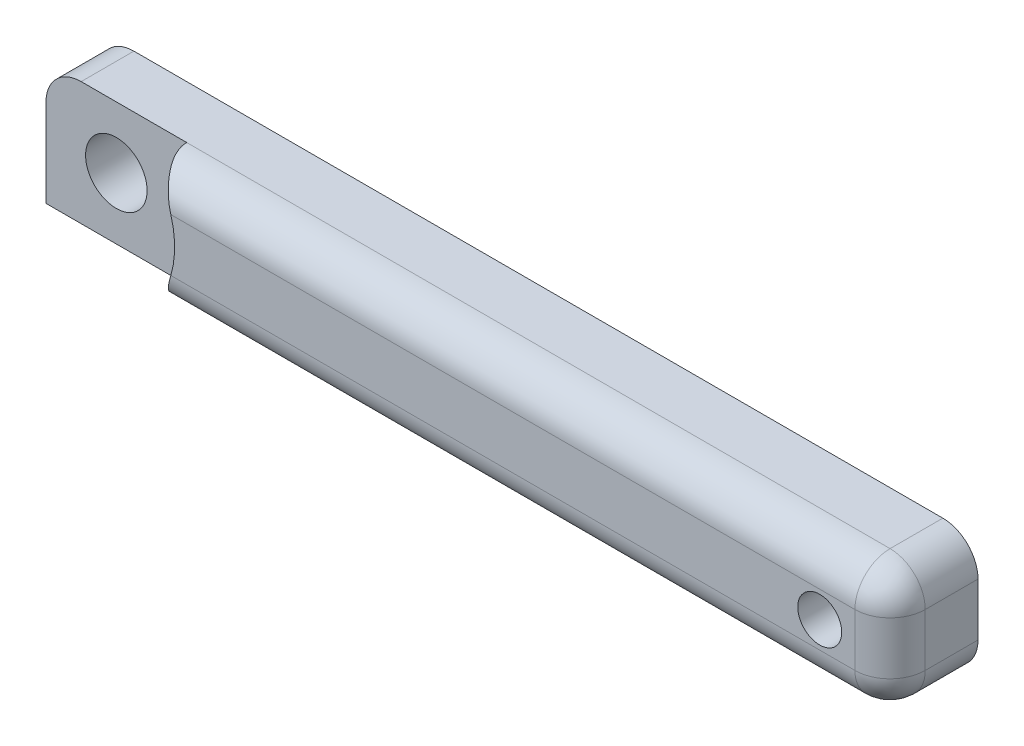
from build123d import *

# Parameters (mm, degrees)
BOSS_EXTRUDE1_DEPTH = 5
SKETCH2_R           = 2.4
CUT_EXTRUDE1_DEPTH  = 3
SKETCH3_R           = 1.25
CUT_EXTRUDE2_DEPTH  = 51.576674466
FILLET1_R           = 2
SKETCH4_R           = 1.75
CUT_EXTRUDE3_DEPTH  = 51.734603576
SKETCH5_R           = 5.315072906
CUT_EXTRUDE4_DEPTH  = 2


with BuildPart() as part:
    # Sketch1 → Boss-Extrude1 (new body)
    with BuildSketch(Plane.XY):
        with BuildLine():
            Line((0, 0), (48, 0))
            ThreePointArc((48, 0), (49.414213562, 0.585786438), (50, 2))
            Line((50, 2), (50, 5))
            ThreePointArc((50, 5), (49.414213562, 6.414213562), (48, 7))
            Line((48, 7), (2, 7))
            ThreePointArc((2, 7), (0.585786438, 6.414213562), (0, 5))
            Line((0, 5), (0, 0))
        make_face()
    extrude(amount=BOSS_EXTRUDE1_DEPTH)

    # Sketch2 → Cut-Extrude1 (cut)
    with BuildSketch(Plane(origin=(0, 0, 0), x_dir=(-1, 0, 0), z_dir=(0, 0, -1))):
        with Locations((-46, 3.5)):
            Circle(SKETCH2_R)
    extrude(amount=-CUT_EXTRUDE1_DEPTH, mode=Mode.SUBTRACT)

    # Sketch3 → Cut-Extrude2 (cut, through all)
    with BuildSketch(Plane(origin=(0, 0, 3), x_dir=(-1, 0, 0), z_dir=(0, 0, -1))):
        with Locations((-46, 3.5)):
            Circle(SKETCH3_R)
    extrude(amount=-CUT_EXTRUDE2_DEPTH, mode=Mode.SUBTRACT)

    # Fillet1
    fillet1_edges = [part.edges().sort_by_distance(p)[0] for p in [
        (49.414213562, 0.585786438, 5),
        (50, 3.5, 5),
        (49.414213562, 6.414213562, 5),
        (25, 7, 5),
        (0.585786438, 6.414213562, 5),
        (0, 2.5, 5),
        (24, 0, 5),
    ]]
    fillet(fillet1_edges, radius=FILLET1_R)

    # Sketch4 → Cut-Extrude3 (cut, through all)
    with BuildSketch(Plane.XY.offset(5)):
        with Locations((4, 3.5)):
            Circle(SKETCH4_R)
    extrude(amount=-CUT_EXTRUDE3_DEPTH, mode=Mode.SUBTRACT)

    # Sketch5 → Cut-Extrude4 (cut)
    with BuildSketch(Plane.XY.offset(5)):
        with Locations((4, 3.5)):
            Circle(SKETCH5_R)
    extrude(amount=-CUT_EXTRUDE4_DEPTH, mode=Mode.SUBTRACT)


solid = part.part
